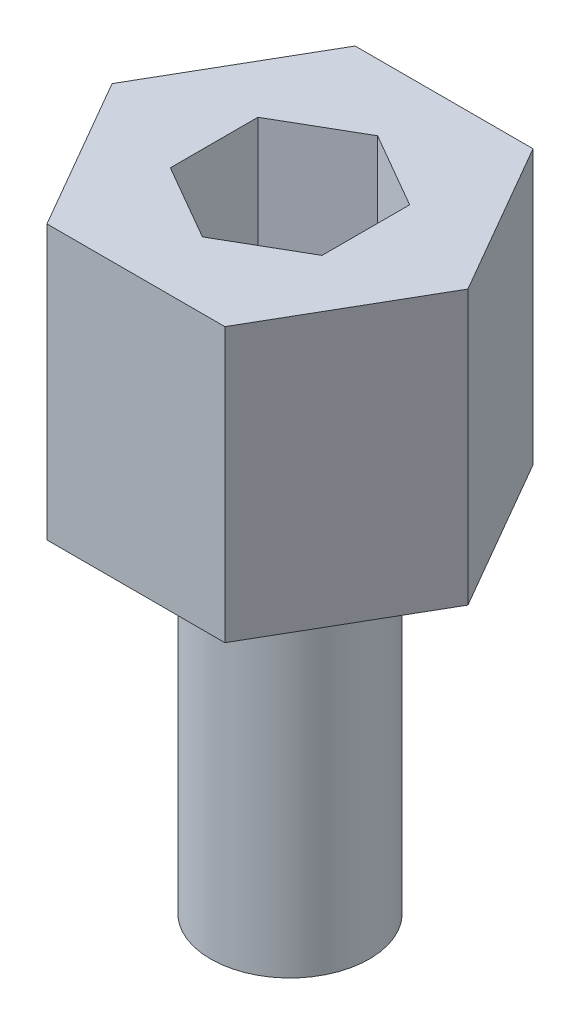
from build123d import *

# Parameters (mm, degrees)
SKETCH1_R           = 2.9
BOSS_EXTRUDE1_DEPTH = 13
BOSS_EXTRUDE2_DEPTH = 10
SKETCH3_R           = 1.6
CUT_EXTRUDE1_DEPTH  = 25
CUT_EXTRUDE2_DEPTH  = 7


with BuildPart() as part:
    # Sketch1 → Boss-Extrude1 (new body)
    with BuildSketch(Plane(origin=(0, 0, 0), x_dir=(1, 0, 0), z_dir=(0, 1, 0))):
        with Locations(Location((0, 0, 0), (0, 0, 270))):
            Circle(SKETCH1_R)
    extrude(amount=BOSS_EXTRUDE1_DEPTH)

    # Sketch2 → Boss-Extrude2 (add)
    with BuildSketch(Plane(origin=(0, 13, 0), x_dir=(1, 0, 0), z_dir=(0, 1, 0))):
        Polygon((6.5, 0), (3.25, 5.629165125), (-3.25, 5.629165125), (-6.5, 0), (-3.25, -5.629165125), (3.25, -5.629165125), align=None)
    extrude(amount=BOSS_EXTRUDE2_DEPTH)

    # Sketch3 → Cut-Extrude1 (cut)
    with BuildSketch(Plane.XZ):
        with Locations(Location((0, 0, 0), (0, 0, 270))):
            Circle(SKETCH3_R)
    extrude(amount=-CUT_EXTRUDE1_DEPTH, mode=Mode.SUBTRACT)

    # Sketch4 → Cut-Extrude2 (cut)
    with BuildSketch(Plane(origin=(0, 23, 0), x_dir=(1, 0, 0), z_dir=(0, 1, 0))):
        Polygon((0, 3.2), (-2.771281292, 1.6), (-2.771281292, -1.6), (0, -3.2), (2.771281292, -1.6), (2.771281292, 1.6), align=None)
    extrude(amount=-CUT_EXTRUDE2_DEPTH, mode=Mode.SUBTRACT)


solid = part.part
